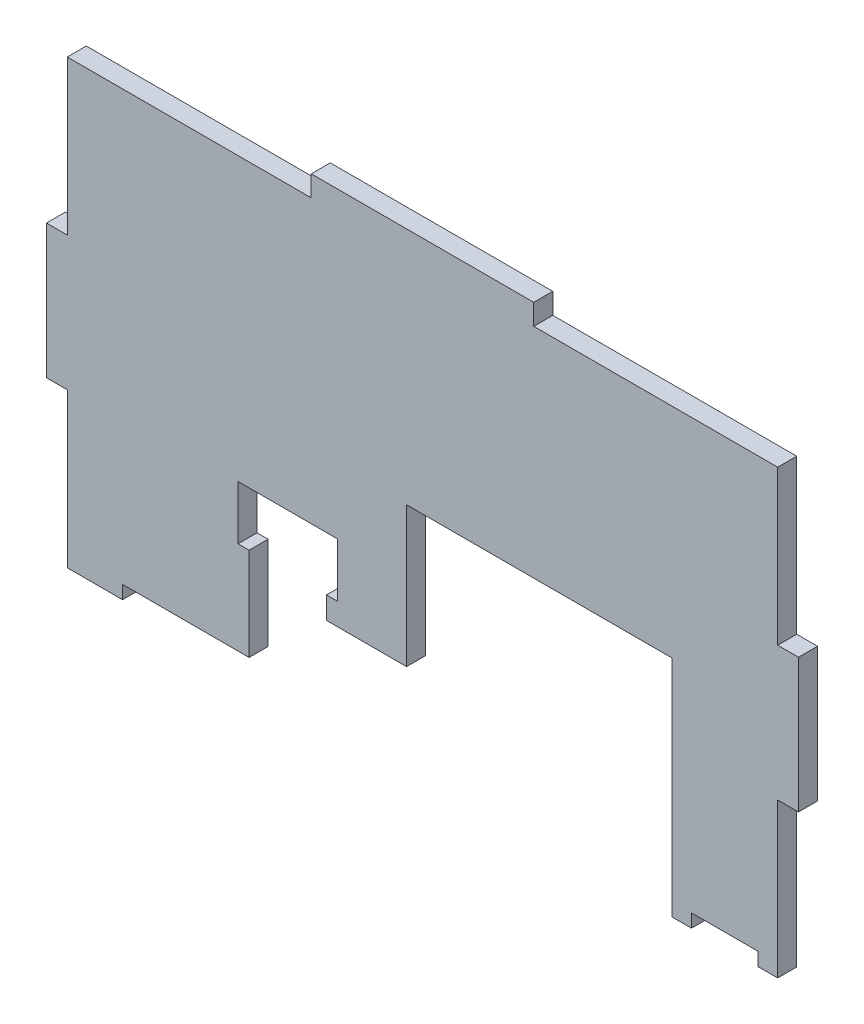
from build123d import *

# Parameters (mm, degrees)
BOSS_EXTRUDE1_DEPTH = 4.3


with BuildPart() as part:
    # Sketch1 → Boss-Extrude1 (new body)
    with BuildSketch(Plane.XY):
        Polygon((0, 34.85), (0, 0), (12.5, 0), (12.5, 3), (27.5, 3), (41.1, 3), (41.1, 24), (38.6, 24), (38.6, 36.2), (61.1, 36.2), (61.1, 24), (58.6, 24), (58.6, 19), (61.1, 19), (76.7, 19), (76.7, 50.7), (136.7, 50.7), (136.7, 0), (141.1, 0), (141.1, 3), (156.1, 3), (156.1, 0), (160.6, 0), (160.6, 34.85), (165.3, 34.85), (165.3, 65.15), (160.6, 65.15), (160.6, 100), (105.45, 100), (105.45, 104.7), (55.15, 104.7), (55.15, 100), (0, 100), (0, 65.15), (-4.7, 65.15), (-4.7, 34.85), align=None)
    extrude(amount=BOSS_EXTRUDE1_DEPTH)


solid = part.part
